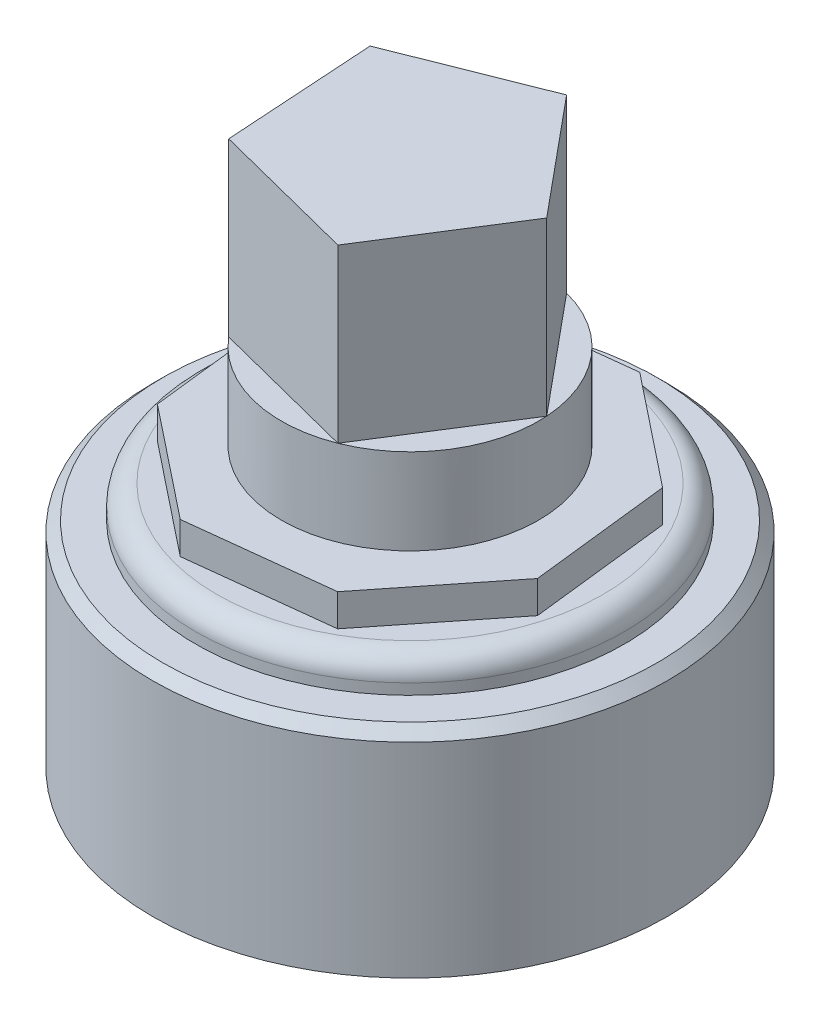
from build123d import *

# Parameters (mm, degrees)
SKETCH1_R           = 38.1
BOSS_EXTRUDE1_DEPTH = 31.75
CHAMFER1_SIZE       = 1.524
SKETCH2_R           = 31.75
BOSS_EXTRUDE3_DEPTH = 4.7625
BOSS_EXTRUDE4_DEPTH = 9.525
SKETCH5_R           = 19.05
BOSS_EXTRUDE5_DEPTH = 12.7
BOSS_EXTRUDE6_DEPTH = 25.4
FILLET2_R           = 3.175


with BuildPart() as part:
    # Sketch1 → Boss-Extrude1 (new body)
    with BuildSketch(Plane(origin=(0, 0, 0), x_dir=(1, 0, 0), z_dir=(0, 1, 0))):
        with Locations(Location((0, 0, 0), (0, 0, 270))):
            Circle(SKETCH1_R)
    extrude(amount=-BOSS_EXTRUDE1_DEPTH)

    # Chamfer1
    chamfer1_edges = [part.edges().sort_by_distance(p)[0] for p in [
        (0, 0, -38.1),
    ]]
    chamfer(chamfer1_edges, length=CHAMFER1_SIZE)

    # Sketch2 → Boss-Extrude3 (add, symmetric)
    with BuildSketch(Plane(origin=(0, 0, 0), x_dir=(1, 0, 0), z_dir=(0, 1, 0))):
        with Locations(Location((0, 0, 0), (0, 0, 90))):
            Circle(SKETCH2_R)
    extrude(amount=BOSS_EXTRUDE3_DEPTH, both=True)

    # Sketch4 → Boss-Extrude4 (add)
    with BuildSketch(Plane(origin=(0, 0, 0), x_dir=(1, 0, 0), z_dir=(0, 1, 0))):
        Polygon((7.571021609, 26.429748164), (-13.335133431, 24.042174872), (-26.429748164, 7.571021609), (-24.042174872, -13.335133431), (-7.571021609, -26.429748164), (13.335133431, -24.042174872), (26.429748164, -7.571021609), (24.042174872, 13.335133431), align=None)
    extrude(amount=BOSS_EXTRUDE4_DEPTH)

    # Sketch5 → Boss-Extrude5 (add)
    with BuildSketch(Plane(origin=(0, 9.525, 0), x_dir=(1, 0, 0), z_dir=(0, 1, 0))):
        with Locations(Location((0, 0, 0), (0, 0, 270))):
            Circle(SKETCH5_R)
    extrude(amount=BOSS_EXTRUDE5_DEPTH)

    # Sketch6 → Boss-Extrude6 (add)
    with BuildSketch(Plane(origin=(0, 22.225, 0), x_dir=(1, 0, 0), z_dir=(0, 1, 0))):
        Polygon((4.716746996, 18.456836072), (-16.095939236, 10.189368975), (-14.664584525, -12.159459721), (7.032727569, -17.704328367), (19.011049196, 1.217583042), align=None)
    extrude(amount=BOSS_EXTRUDE6_DEPTH)

    # Fillet2
    fillet2_edges = [part.edges().sort_by_distance(p)[0] for p in [
        (0, 4.7625, 31.75),
    ]]
    fillet(fillet2_edges, radius=FILLET2_R)


solid = part.part
